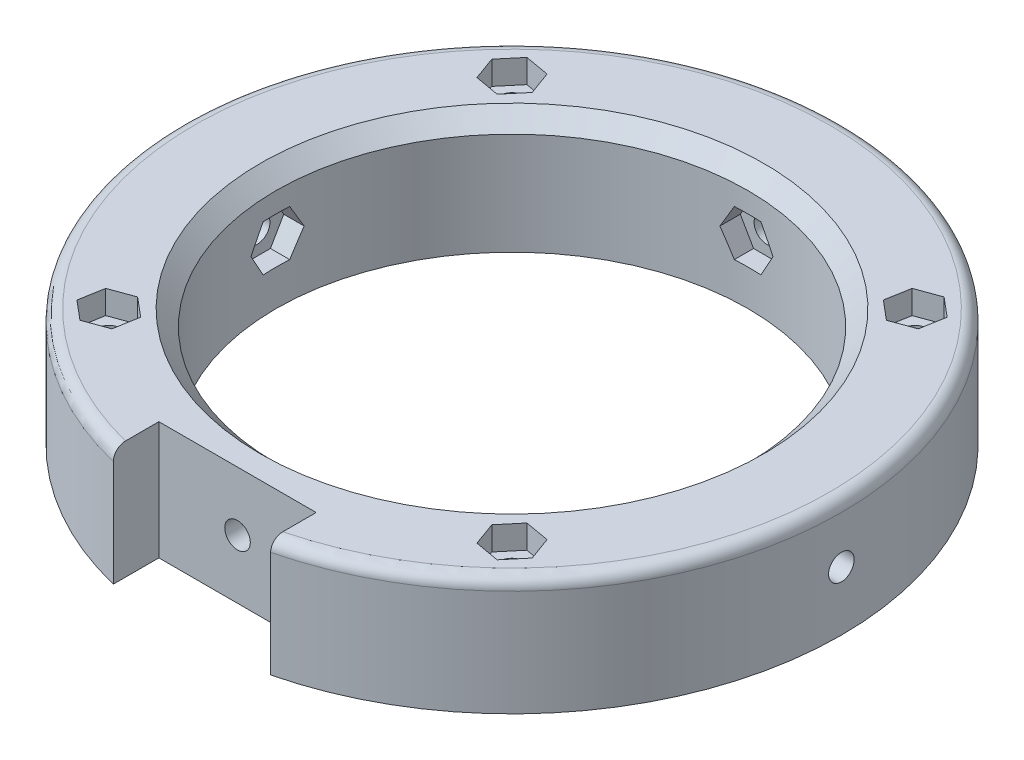
from build123d import *

# Parameters (mm, degrees)
SKETCH1_R               = 41.9
TOP_PART_DEPTH          = 15
SKETCH2_R               = 30
CUT_EXTRUDE1_DEPTH      = 20
FILLET1_R               = 1.5
CHAMFER1_SIZE           = 2
SKETCH8_7_R             = 1.625
CUT_EXTRUDE8_DEPTH      = 3
SKETCH8_R               = 1.625
CUT_EXTRUDE7_DEPTH      = 62.124626857
CUT_EXTRUDE11_DEPTH     = 62.124626857
SKETCH15_R              = 1.625
CUT_EXTRUDE14_DEPTH     = 10
CUT_EXTRUDE15_DEPTH     = 10
CIRPATTERN1_COUNT       = 4
CIRPATTERN2_COUNT       = 4
SKETCH3_R               = 41.9
BOTTOM_PART_DEPTH       = 20
SKETCH6_R               = 37.9
CUT_EXTRUDE3_DEPTH      = 63.076324134
SKETCH_1_W              = 43
SKETCH_1_H              = 43
EXTRUDE_1_DEPTH         = 8
FILLET_1_R              = 5
CUT_EXTRUDE4_DEPTH      = 63.076324134
CUT_EXTRUDE4_DEPTH_BACK = 63.076324134
SKETCH7_R               = 17.5
SKETCH7_R_2             = 1
SKETCH12_W              = 39.5
SKETCH12_H              = 39.5
CUT_EXTRUDE10_DEPTH     = 8.5
FILLET3_R               = 2
SKETCH17_R              = 1.625
CUT_EXTRUDE16_DEPTH     = 63.076324134
SKETCH18_R              = 3
CUT_EXTRUDE17_DEPTH     = 63.076324134
SKETCH19_R              = 2.75
BOSS_EXTRUDE1_DEPTH     = 18.5
SKETCH20_W              = 87.79908129
SKETCH20_H              = 93.09964502
CUT_EXTRUDE18_DEPTH     = 10
SKETCH21_W              = 20
SKETCH21_H              = 8.651798588
CUT_EXTRUDE19_DEPTH     = 15
SKETCH23_R              = 30
CUT_EXTRUDE21_DEPTH     = 65.313451299
SKETCH24_R              = 41.9
CUT_EXTRUDE22_DEPTH     = 10


with BuildPart() as part:
    # Sketch1 → Top-Part (new body)
    with BuildSketch(Plane(origin=(0, 0, 0), x_dir=(1, 0, 0), z_dir=(0, 1, 0))):
        with Locations(Location((0, 0, 0), (0, 0, 270))):
            Circle(SKETCH1_R)
    extrude(amount=TOP_PART_DEPTH)

    # Sketch2 → Cut-Extrude1 (cut)
    with BuildSketch(Plane(origin=(0, 15, 0), x_dir=(1, 0, 0), z_dir=(0, 1, 0))):
        with Locations(Location((0, 0, 0), (0, 0, 270))):
            Circle(SKETCH2_R)
    extrude(amount=-CUT_EXTRUDE1_DEPTH, mode=Mode.SUBTRACT)

    # Fillet1
    fillet1_edges = [part.edges().sort_by_distance(p)[0] for p in [
        (0, 15, -41.9),
    ]]
    fillet(fillet1_edges, radius=FILLET1_R)

    # Chamfer1
    chamfer1_edges = [part.edges().sort_by_distance(p)[0] for p in [
        (0, 15, -30),
    ]]
    chamfer(chamfer1_edges, length=CHAMFER1_SIZE)

    # Sketch8<7> → Cut-Extrude8 (cut)
    # profile 1 of 4: a face of its own
    with BuildSketch(Plane(origin=(0, 15, 0), x_dir=(1, 0, 0), z_dir=(0, 1, 0))):
        Polygon((25.083213555, 22.516777398), (28.056316743, 23.598898462), (28.605724005, 26.714741882), (26.182028081, 28.748464238), (23.208924893, 27.666343174), (22.659517631, 24.550499754), align=None)
        with Locations(Location((25.632620818, 25.632620818, 0), (0, 0, 270))):
            Circle(SKETCH8_7_R, mode=Mode.SUBTRACT)
    # profile 2 of 4: a face of its own
    with BuildSketch(Plane(origin=(0, 15, 0), x_dir=(1, 0, 0), z_dir=(0, 1, 0))):
        Polygon((-22.516777398, 25.083213555), (-23.598898462, 28.056316743), (-26.714741882, 28.605724005), (-28.748464238, 26.182028081), (-27.666343174, 23.208924893), (-24.550499754, 22.659517631), align=None)
        with Locations(Location((-25.632620818, 25.632620818, 0), (0, 0, 270))):
            Circle(SKETCH8_7_R, mode=Mode.SUBTRACT)
    # profile 3 of 4: a face of its own
    with BuildSketch(Plane(origin=(0, 15, 0), x_dir=(1, 0, 0), z_dir=(0, 1, 0))):
        Polygon((22.516777398, -25.083213555), (23.598898462, -28.056316743), (26.714741882, -28.605724005), (28.748464238, -26.182028081), (27.666343174, -23.208924893), (24.550499754, -22.659517631), align=None)
        with Locations(Location((25.632620818, -25.632620818, 0), (0, 0, 270))):
            Circle(SKETCH8_7_R, mode=Mode.SUBTRACT)
    # profile 4 of 4: a face of its own
    with BuildSketch(Plane(origin=(0, 15, 0), x_dir=(1, 0, 0), z_dir=(0, 1, 0))):
        Polygon((-25.083213555, -22.516777398), (-28.056316743, -23.598898462), (-28.605724005, -26.714741882), (-26.182028081, -28.748464238), (-23.208924893, -27.666343174), (-22.659517631, -24.550499754), align=None)
        with Locations(Location((-25.632620818, -25.632620818, 0), (0, 0, 270))):
            Circle(SKETCH8_7_R, mode=Mode.SUBTRACT)
    extrude(amount=-CUT_EXTRUDE8_DEPTH, mode=Mode.SUBTRACT)

    # Sketch8 → Cut-Extrude7 (cut, through all)
    with BuildSketch(Plane(origin=(0, 15, 0), x_dir=(1, 0, 0), z_dir=(0, 1, 0))):
        with Locations(Location((-25.632620818, 25.632620818, 0), (0, 0, 270))):
            Circle(SKETCH8_R)
        with Locations(Location((25.632620818, 25.632620818, 0), (0, 0, 270))):
            Circle(SKETCH8_R)
        with Locations(Location((25.632620818, -25.632620818, 0), (0, 0, 270))):
            Circle(SKETCH8_R)
        with Locations(Location((-25.632620818, -25.632620818, 0), (0, 0, 270))):
            Circle(SKETCH8_R)
    extrude(amount=-CUT_EXTRUDE7_DEPTH, mode=Mode.SUBTRACT)

    # Sketch13 → Cut-Extrude11 (cut, through all)
    with BuildSketch(Plane.XZ):
        with BuildLine():
            Line((-10, 35.519149765), (-10, 40.689187753))
            ThreePointArc((-10, 40.689187753), (0, 41.9), (10, 40.689187753))
            Line((10, 40.689187753), (10, 35.519149765))
            ThreePointArc((10, 35.519149765), (0, 36.9), (-10, 35.519149765))
        make_face()
    extrude(amount=-CUT_EXTRUDE11_DEPTH, mode=Mode.SUBTRACT)

    # Sketch15 → Cut-Extrude14 (cut, symmetric)
    with BuildSketch(Plane.XY.offset(32.4)):
        with Locations(Location((0, 7.5, 0), (0, 0, 180))):
            Circle(SKETCH15_R)
    cut_extrude14 = extrude(amount=CUT_EXTRUDE14_DEPTH, both=True, mode=Mode.SUBTRACT)

    # Sketch16 → Cut-Extrude15 (cut)
    with BuildSketch(Plane.XY.offset(32.4)):
        Polygon((3.377499075, 7.5), (1.688749537, 10.425), (-1.688749537, 10.425), (-3.377499075, 7.5), (-1.688749537, 4.575), (1.688749537, 4.575), align=None)
    cut_extrude15 = extrude(amount=-CUT_EXTRUDE15_DEPTH, mode=Mode.SUBTRACT)

    # CirPattern1: Cut-Extrude14 ×4 about axis
    cirpattern1_axis = Axis((0, 0, 0), (0, 1, 0))
    for i in range(1, CIRPATTERN1_COUNT):
        add(cut_extrude14.rotate(cirpattern1_axis, i * 360 / CIRPATTERN1_COUNT), mode=Mode.SUBTRACT)

    # CirPattern2: Cut-Extrude15 ×4 about axis
    cirpattern2_axis = Axis((0, 0, 0), (0, 1, 0))
    for i in range(1, CIRPATTERN2_COUNT):
        add(cut_extrude15.rotate(cirpattern2_axis, i * 360 / CIRPATTERN2_COUNT), mode=Mode.SUBTRACT)

    # Sketch21 → Cut-Extrude19 (cut)
    with BuildSketch(Plane(origin=(0, 15, 0), x_dir=(1, 0, 0), z_dir=(0, 1, 0))):
        with Locations((0, -39.225899294)):
            Rectangle(SKETCH21_W, SKETCH21_H)
    extrude(amount=-CUT_EXTRUDE19_DEPTH, mode=Mode.SUBTRACT)


with BuildPart() as body_2:
    # Sketch3 → Bottom-Part (new body)
    with BuildSketch(Plane.XZ):
        with Locations(Location((0, 0, 0), (0, 0, 270))):
            Circle(SKETCH3_R)
    extrude(amount=BOTTOM_PART_DEPTH)

    # Sketch6 → Cut-Extrude3 (cut, through all)
    with BuildSketch(Plane(origin=(0, -1.5, 0), x_dir=(1, 0, 0), z_dir=(0, 1, 0))):
        with Locations(Location((0, 0, 0), (0, 0, 270))):
            Circle(SKETCH6_R)
    extrude(amount=-CUT_EXTRUDE3_DEPTH, mode=Mode.SUBTRACT)

    # ｽｹｯﾁ1 → ﾎﾞｽ - 押し出し1 (add)
    with BuildSketch(Plane(origin=(0, 0, 0), x_dir=(1, 0, 0), z_dir=(0, 1, 0))):
        Rectangle(SKETCH_1_W, SKETCH_1_H)
    extrude(amount=EXTRUDE_1_DEPTH)

    # ﾌｨﾚｯﾄ1
    fillet_1_edges = [body_2.edges().sort_by_distance(p)[0] for p in [
        (-21.5, 4, -21.5),
        (-21.5, 4, 21.5),
        (21.5, 4, 21.5),
        (21.5, 4, -21.5),
    ]]
    fillet(fillet_1_edges, radius=FILLET_1_R)

    # Sketch7 → Cut-Extrude4 (cut, two sides: drawn at the far end of the back side and taken through both)
    with BuildSketch(Plane(origin=(0, -1.5, 0), x_dir=(1, 0, 0), z_dir=(0, 1, 0)).offset(-CUT_EXTRUDE4_DEPTH_BACK)):
        with Locations(Location((0, 0, 0), (0, 0, 270))):
            Circle(SKETCH7_R)
        with Locations(Location((17, -17, 0), (0, 0, 270))):
            Circle(SKETCH7_R_2)
        with Locations(Location((-17, -17, 0), (0, 0, 270))):
            Circle(SKETCH7_R_2)
        with Locations(Location((-17, 17, 0), (0, 0, 270))):
            Circle(SKETCH7_R_2)
        with Locations(Location((17, 17, 0), (0, 0, 270))):
            Circle(SKETCH7_R_2)
    extrude(amount=CUT_EXTRUDE4_DEPTH + CUT_EXTRUDE4_DEPTH_BACK, mode=Mode.SUBTRACT)

    # Sketch12 → Cut-Extrude10 (cut)
    with BuildSketch(Plane.XZ.offset(1.5)):
        Rectangle(SKETCH12_W, SKETCH12_H)
    extrude(amount=-CUT_EXTRUDE10_DEPTH, mode=Mode.SUBTRACT)

    # Fillet3
    fillet3_edges = [body_2.edges().sort_by_distance(p)[0] for p in [
        (-19.75, 2.75, -19.75),
        (-19.75, 2.75, 19.75),
        (19.75, 2.75, 19.75),
        (19.75, 2.75, -19.75),
    ]]
    fillet(fillet3_edges, radius=FILLET3_R)

    # Sketch17 → Cut-Extrude16 (cut, through all)
    with BuildSketch(Plane.XZ.offset(1.5)):
        with Locations(Location((25.632620818, -25.632620818, 0), (0, 0, 90))):
            Circle(SKETCH17_R)
        with Locations(Location((-25.632620818, -25.632620818, 0), (0, 0, 90))):
            Circle(SKETCH17_R)
        with Locations(Location((25.632620818, 25.632620818, 0), (0, 0, 90))):
            Circle(SKETCH17_R)
        with Locations(Location((-25.632620818, 25.632620818, 0), (0, 0, 90))):
            Circle(SKETCH17_R)
    extrude(amount=-CUT_EXTRUDE16_DEPTH, mode=Mode.SUBTRACT)

    # Sketch18 → Cut-Extrude17 (cut, through all)
    with BuildSketch(Plane.XZ.offset(1.5)):
        with Locations((-25.632620818, 25.632620818)):
            Circle(SKETCH18_R)
        with Locations((25.632620818, 25.632620818)):
            Circle(SKETCH18_R)
        with Locations((25.632620818, -25.632620818)):
            Circle(SKETCH18_R)
        with Locations((-25.632620818, -25.632620818)):
            Circle(SKETCH18_R)
    extrude(amount=CUT_EXTRUDE17_DEPTH, mode=Mode.SUBTRACT)

    # Sketch19 → Boss-Extrude1 (add)
    # profile 1 of 4: a face of its own
    with BuildSketch(Plane.XZ.offset(1.5)):
        with BuildLine():
            Line((-6, 33), (-6, 37.422052322))
            ThreePointArc((-6, 37.422052322), (0, 37.9), (6, 37.422052322))
            Line((6, 37.422052322), (6, 33))
            ThreePointArc((6, 33), (0, 27), (-6, 33))
        make_face()
        with Locations(Location((0, 33, 0), (0, 0, 270))):
            Circle(SKETCH19_R, mode=Mode.SUBTRACT)
    # profile 2 of 4: a face of its own
    with BuildSketch(Plane.XZ.offset(1.5)):
        with BuildLine():
            Line((33, 6), (37.422052322, 6))
            ThreePointArc((37.422052322, 6), (37.9, 0), (37.422052322, -6))
            Line((37.422052322, -6), (33, -6))
            ThreePointArc((33, -6), (27, 0), (33, 6))
        make_face()
        with Locations(Location((33, 0, 0), (0, 0, 270))):
            Circle(SKETCH19_R, mode=Mode.SUBTRACT)
    # profile 3 of 4: a face of its own
    with BuildSketch(Plane.XZ.offset(1.5)):
        with BuildLine():
            Line((6, -33), (6, -37.422052322))
            ThreePointArc((6, -37.422052322), (0, -37.9), (-6, -37.422052322))
            Line((-6, -37.422052322), (-6, -33))
            ThreePointArc((-6, -33), (0, -27), (6, -33))
        make_face()
        with Locations(Location((0, -33, 0), (0, 0, 270))):
            Circle(SKETCH19_R, mode=Mode.SUBTRACT)
    # profile 4 of 4: a face of its own
    with BuildSketch(Plane.XZ.offset(1.5)):
        with BuildLine():
            Line((-33, -6), (-37.422052322, -6))
            ThreePointArc((-37.422052322, -6), (-37.9, 0), (-37.422052322, 6))
            Line((-37.422052322, 6), (-33, 6))
            ThreePointArc((-33, 6), (-27, 0), (-33, -6))
        make_face()
        with Locations(Location((-33, 0, 0), (0, 0, 270))):
            Circle(SKETCH19_R, mode=Mode.SUBTRACT)
    extrude(amount=BOSS_EXTRUDE1_DEPTH)

    # Sketch20 → Cut-Extrude18 (cut)
    with BuildSketch(Plane.XZ.offset(20)):
        Rectangle(SKETCH20_W, SKETCH20_H)
    extrude(amount=-CUT_EXTRUDE18_DEPTH, mode=Mode.SUBTRACT)

    # Sketch23 → Cut-Extrude21 (cut, through all)
    with BuildSketch(Plane(origin=(0, 15, 0), x_dir=(1, 0, 0), z_dir=(0, 1, 0))):
        with Locations(Location((0, 0, 0), (0, 0, 270))):
            Circle(SKETCH23_R)
    extrude(amount=-CUT_EXTRUDE21_DEPTH, mode=Mode.SUBTRACT)

    # Sketch24 → Cut-Extrude22 (cut)
    with BuildSketch(Plane.XZ.offset(10)):
        Circle(SKETCH24_R)
    extrude(amount=-CUT_EXTRUDE22_DEPTH, mode=Mode.SUBTRACT)


solid = part.part
